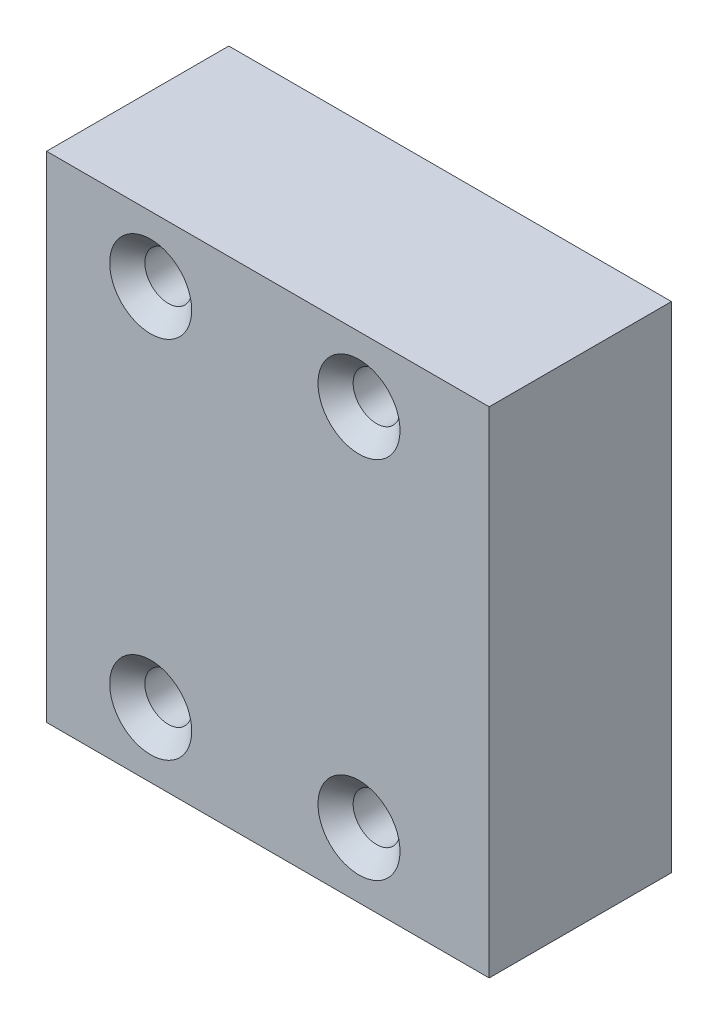
from build123d import *

# Parameters (mm, degrees)
SKETCH1_W                                       = 34
SKETCH1_H                                       = 38
BOSS_EXTRUDE1_DEPTH                             = 14
CSK_FOR_M3_FLAT_HEAD_MACHINE_SCREW1_D           = 3.6
CSK_FOR_M3_FLAT_HEAD_MACHINE_SCREW1_CSINK_D     = 6.3
CSK_FOR_M3_FLAT_HEAD_MACHINE_SCREW1_CSINK_ANGLE = 90


with BuildPart() as part:
    # Sketch1 → Boss-Extrude1 (new body)
    with BuildSketch(Plane.XY):
        Rectangle(SKETCH1_W, SKETCH1_H)
    extrude(amount=BOSS_EXTRUDE1_DEPTH)

    # CSK for M3 Flat Head Machine Screw1 (through all)
    with Locations(Plane.XY.offset(14)):
        with Locations((-9, 14), (-9, -14), (7, -14), (7, 14)):
            CounterSinkHole(CSK_FOR_M3_FLAT_HEAD_MACHINE_SCREW1_D / 2, CSK_FOR_M3_FLAT_HEAD_MACHINE_SCREW1_CSINK_D / 2, counter_sink_angle=CSK_FOR_M3_FLAT_HEAD_MACHINE_SCREW1_CSINK_ANGLE)


solid = part.part
